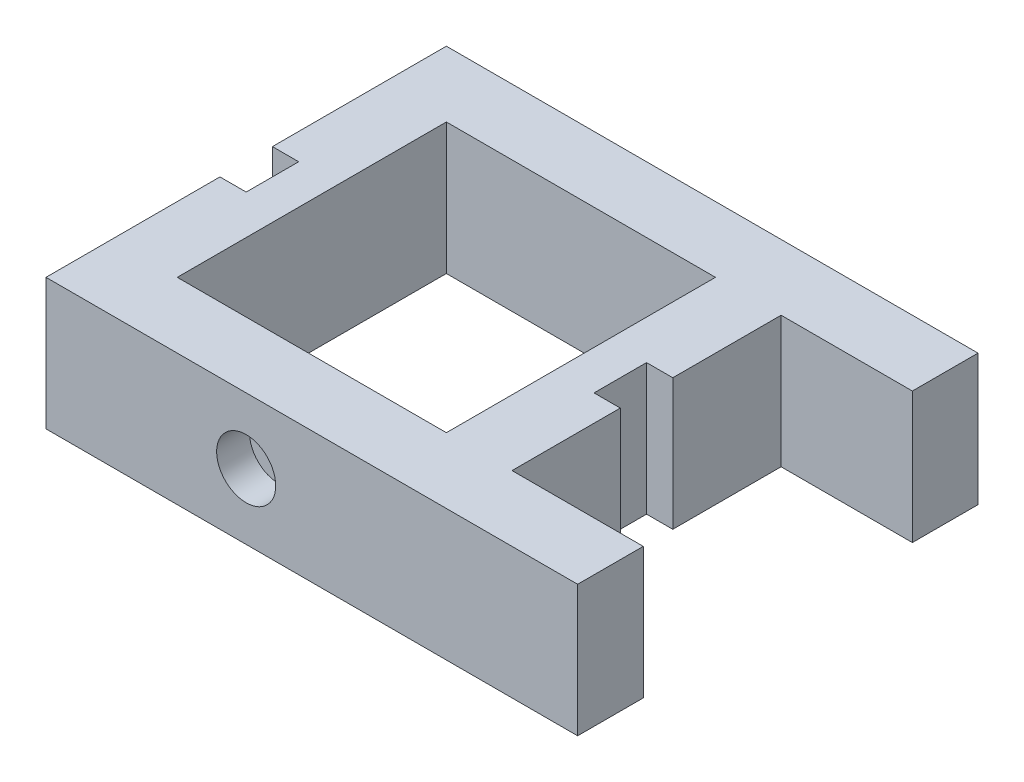
from build123d import *

# Parameters (mm, degrees)
SKETCH1_W           = 41
SKETCH1_H           = 41
BOSS_EXTRUDE1_DEPTH = 20
SKETCH2_R           = 2.5
CUT_EXTRUDE1_DEPTH  = 40
SKETCH3_R           = 4.5
CUT_EXTRUDE2_DEPTH  = 5


with BuildPart() as part:
    # Sketch1 → Boss-Extrude1 (new body)
    with BuildSketch(Plane(origin=(0, 0, 0), x_dir=(1, 0, 0), z_dir=(0, 1, 0))):
        Polygon((-51, 30.5), (10, 30.5), (30, 30.5), (30, 20.5), (10, 20.5), (10, 4), (6, 4), (6, -4), (10, -4), (10, -20.5), (30, -20.5), (30, -30.5), (10, -30.5), (-51, -30.5), (-51, -4), (-47, -4), (-47, 4), (-51, 4), align=None)
        with Locations((-20.5, 0)):
            Rectangle(SKETCH1_W, SKETCH1_H, mode=Mode.SUBTRACT)
    extrude(amount=BOSS_EXTRUDE1_DEPTH)

    # Sketch2 → Cut-Extrude1 (cut)
    with BuildSketch(Plane.XY.offset(30.5)):
        with Locations((-20.5, 10)):
            Circle(SKETCH2_R)
    extrude(amount=-CUT_EXTRUDE1_DEPTH, mode=Mode.SUBTRACT)

    # Sketch3 → Cut-Extrude2 (cut)
    with BuildSketch(Plane.XY.offset(30.5)):
        with Locations((-20.5, 10)):
            Circle(SKETCH3_R)
    extrude(amount=-CUT_EXTRUDE2_DEPTH, mode=Mode.SUBTRACT)


solid = part.part
